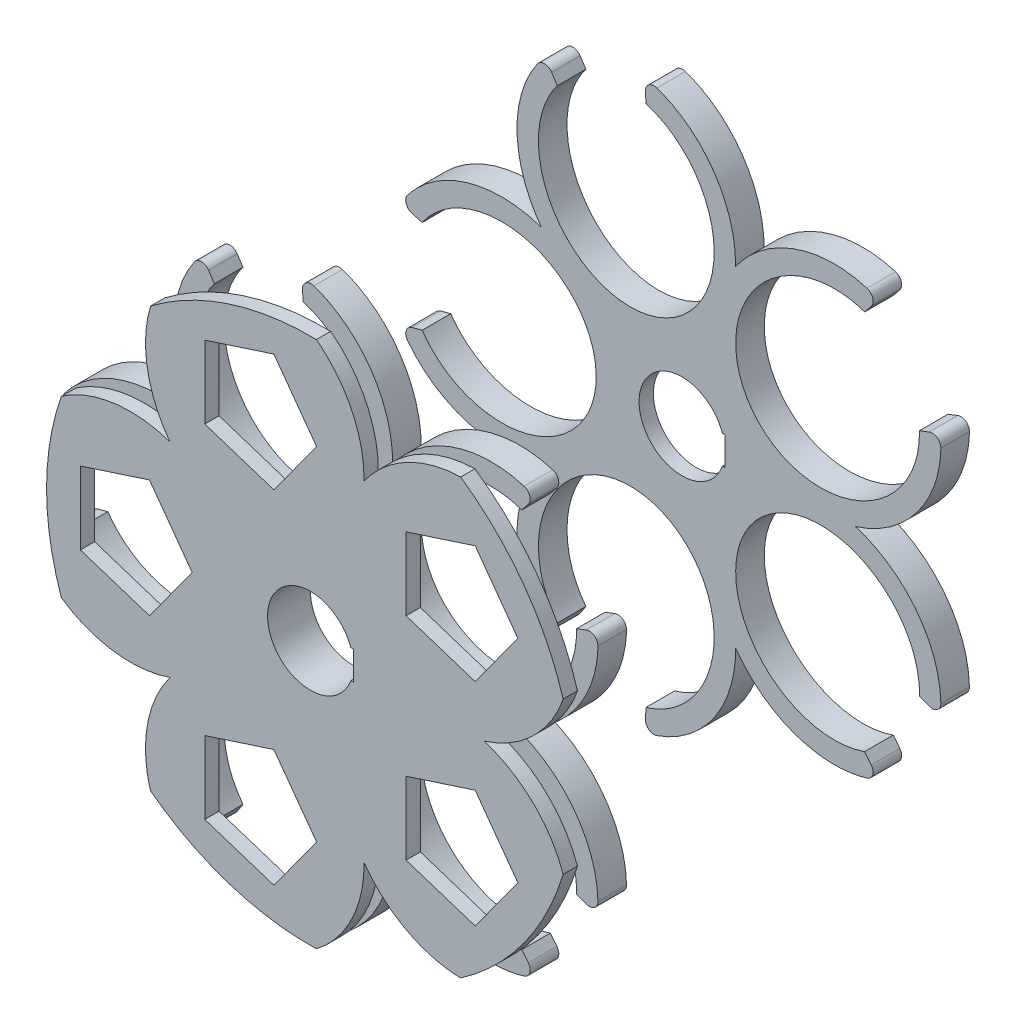
from build123d import *

# Parameters (mm, degrees)
BOSS_EXTRUDE1_DEPTH = 10
CIRPATTERN1_COUNT   = 5
SKETCH4_R           = 15
BOSS_EXTRUDE2_DEPTH = 5
LPATTERN1_COUNT     = 2
LPATTERN1_PITCH     = 120
BOSS_EXTRUDE3_START = 5
SKETCH5_R           = 15
BOSS_EXTRUDE3_DEPTH = 5
BOSS_EXTRUDE4_START = 5
SKETCH6_R           = 15
BOSS_EXTRUDE4_DEPTH = 5
SKETCH7_W           = 0.857864376
SKETCH7_H           = 10
CUT_EXTRUDE1_DEPTH  = 197.479113475


with BuildPart() as part:
    # Sketch1 → Boss-Extrude1 (new body)
    with BuildSketch(Plane.XY):
        with BuildLine():
            Line((-90.882850735, 16.313510687), (-94.428028859, 17.263438303))
            ThreePointArc((-94.428028859, 17.263438303), (-96.488628296, 19.185967093), (-96.045623977, 21.969118933))
            add(Edge.make_bspline(
                [(-96.045623977, -21.969118933), (-22.5, -119.359328544), (-22.5, 0), (-22.5, 119.359328544), (-96.045623977, 21.969118933)],
                knots=[3.758033427, 3.758033427, 3.758033427, 6.283185307, 6.283185307, 8.808337187, 8.808337187, 8.808337187], degree=2, weights=[1, 0.303363369, 1, 0.303363369, 1]))
            ThreePointArc((-96.045623977, -21.969118933), (-96.488628296, -19.185967093), (-94.428028859, -17.263438303))
            Line((-94.428028859, -17.263438303), (-90.882850735, -16.313510687))
            add(Edge.make_bspline(
                [(-90.882850735, -16.313510687), (-30, -105.204250416), (-30, 0), (-30, 105.204250416), (-90.882850735, 16.313510687)],
                knots=[3.705945592, 3.705945592, 3.705945592, 6.283185307, 6.283185307, 8.860425023, 8.860425023, 8.860425023], degree=2, weights=[1, 0.2784467, 1, 0.2784467, 1]))
        make_face()
    extrude(amount=BOSS_EXTRUDE1_DEPTH)


with BuildPart() as cirpattern1_1:
    # CirPattern1: pattern copy
    add(part.part.rotate(Axis((0, 0, 0), (0, 0, 1)), 1 * 360 / CIRPATTERN1_COUNT))


with BuildPart() as cirpattern1_2:
    # CirPattern1: pattern copy
    add(part.part.rotate(Axis((0, 0, 0), (0, 0, 1)), 2 * 360 / CIRPATTERN1_COUNT))


with BuildPart() as cirpattern1_3:
    # CirPattern1: pattern copy
    add(part.part.rotate(Axis((0, 0, 0), (0, 0, 1)), 3 * 360 / CIRPATTERN1_COUNT))


with BuildPart() as cirpattern1_4:
    # CirPattern1: pattern copy
    add(part.part.rotate(Axis((0, 0, 0), (0, 0, 1)), 4 * 360 / CIRPATTERN1_COUNT))


with BuildPart() as part_1:
    add(part.part)

    add(cirpattern1_1.part)  # Boss-Extrude2 merges CirPattern1_1

    add(cirpattern1_2.part)  # Boss-Extrude2 merges CirPattern1_2

    add(cirpattern1_3.part)  # Boss-Extrude2 merges CirPattern1_3

    add(cirpattern1_4.part)  # Boss-Extrude2 merges CirPattern1_4
    # Sketch4 → Boss-Extrude2 (add)
    with BuildSketch(Plane.XY.offset(10)):
        with BuildLine():
            add(Edge.make_bspline(
                [(11.314250367, -34.821682092), (-4.282878688, -13.18134523), (-29.621092019, -21.520983078)],
                knots=[5.681125071, 5.681125071, 5.681125071, 6.885245543, 6.885245543, 6.885245543], degree=2, weights=[1, 0.824170567, 1]))
            add(Edge.make_bspline(
                [(36.613683304, 0), (11.212721975, -8.146519369), (11.314250367, -34.821682092)],
                knots=[5.681125071, 5.681125071, 5.681125071, 6.885245543, 6.885245543, 6.885245543], degree=2, weights=[1, 0.824170567, 1]))
            add(Edge.make_bspline(
                [(11.314250367, 34.821682092), (11.212721975, 8.146519369), (36.613683304, 0)],
                knots=[5.681125071, 5.681125071, 5.681125071, 6.885245543, 6.885245543, 6.885245543], degree=2, weights=[1, 0.824170567, 1]))
            add(Edge.make_bspline(
                [(-29.621092019, 21.520983078), (-4.282878688, 13.18134523), (11.314250367, 34.821682092)],
                knots=[5.681125071, 5.681125071, 5.681125071, 6.885245543, 6.885245543, 6.885245543], degree=2, weights=[1, 0.824170567, 1]))
            add(Edge.make_bspline(
                [(-29.621092019, -21.520983078), (-13.859686574, 0), (-29.621092019, 21.520983078)],
                knots=[2.539532418, 2.539532418, 2.539532418, 3.74365289, 3.74365289, 3.74365289], degree=2, weights=[1, 0.824170567, 1]))
        make_face()
        Circle(SKETCH4_R, mode=Mode.SUBTRACT)
    extrude(amount=-BOSS_EXTRUDE2_DEPTH)


with BuildPart() as lpattern1_1:
    # LPattern1: pattern copy
    add(part_1.part.moved(Location(Vector(0, 0, 1) * (1 * LPATTERN1_PITCH))))

    # Sketch5 → Boss-Extrude3 (add)
    with BuildSketch(Plane.XY.offset(130).offset(BOSS_EXTRUDE3_START)):
        Polygon((9.549150281, 29.389262615), (-25, 18.1635632), (-25, -18.1635632), (9.549150281, -29.389262615), (30.901699437, 0), align=None)
        Circle(SKETCH5_R, mode=Mode.SUBTRACT)
    extrude(amount=-BOSS_EXTRUDE3_DEPTH)

    # Sketch6 → Boss-Extrude4 (add)
    with BuildSketch(Plane.XY.offset(135).offset(BOSS_EXTRUDE4_START)):
        with BuildLine():
            ThreePointArc((-55.942472773, -73.459260333), (-28.533202922, -87.816168897), (2.080141313, -92.311950477))
            add(Edge.make_bspline(
                [(2.080141313, -92.311950477), (19.096140546, -79.431875664), (18.773008887, -57.777380395)],
                knots=[0.931883543, 0.931883543, 0.931883543, 1.919857155, 1.919857155, 1.919857155], degree=2, weights=[1, 0.880449557, 1]))
            add(Edge.make_bspline(
                [(18.773008887, -57.777380395), (31.239782848, -75.486167096), (52.576733428, -75.904613106)],
                knots=[1.221735499, 1.221735499, 1.221735499, 2.209709111, 2.209709111, 2.209709111], degree=2, weights=[1, 0.880449557, 1]))
            ThreePointArc((52.576733428, -75.904613106), (74.700895058, -54.27337714), (88.436681049, -26.547629531))
            add(Edge.make_bspline(
                [(88.436681049, -26.547629531), (81.445234908, -6.384290573), (60.750732901, 0)],
                knots=[4.073476196, 4.073476196, 4.073476196, 5.061449808, 5.061449808, 5.061449808], degree=2, weights=[1, 0.880449557, 1]))
            add(Edge.make_bspline(
                [(60.750732901, 0), (81.445234908, 6.384290573), (88.436681049, 26.547629531)],
                knots=[1.221735499, 1.221735499, 1.221735499, 2.209709111, 2.209709111, 2.209709111], degree=2, weights=[1, 0.880449557, 1]))
            ThreePointArc((88.436681049, 26.547629531), (74.700895058, 54.27337714), (52.576733428, 75.904613106))
            add(Edge.make_bspline(
                [(52.576733428, 75.904613106), (31.239782848, 75.486167096), (18.773008887, 57.777380395)],
                knots=[4.073476196, 4.073476196, 4.073476196, 5.061449808, 5.061449808, 5.061449808], degree=2, weights=[1, 0.880449557, 1]))
            add(Edge.make_bspline(
                [(18.773008887, 57.777380395), (19.096140546, 79.431875664), (2.080141313, 92.311950477)],
                knots=[4.363328152, 4.363328152, 4.363328152, 5.351301765, 5.351301765, 5.351301765], degree=2, weights=[1, 0.880449557, 1]))
            ThreePointArc((2.080141313, 92.311950477), (-28.533202922, 87.816168897), (-55.942472773, 73.459260333))
            add(Edge.make_bspline(
                [(-55.942472773, 73.459260333), (-62.137987306, 53.037307518), (-49.148375337, 35.708384865)],
                knots=[0.931883543, 0.931883543, 0.931883543, 1.919857155, 1.919857155, 1.919857155], degree=2, weights=[1, 0.880449557, 1]))
            add(Edge.make_bspline(
                [(-49.148375337, 35.708384865), (-69.643170996, 42.707308378), (-87.151083016, 30.504293432)],
                knots=[4.363328152, 4.363328152, 4.363328152, 5.351301765, 5.351301765, 5.351301765], degree=2, weights=[1, 0.880449557, 1]))
            ThreePointArc((-87.151083016, 30.504293432), (-92.335384272, 0), (-87.151083016, -30.504293432))
            add(Edge.make_bspline(
                [(-87.151083016, -30.504293432), (-69.643170996, -42.707308378), (-49.148375337, -35.708384865)],
                knots=[0.931883543, 0.931883543, 0.931883543, 1.919857155, 1.919857155, 1.919857155], degree=2, weights=[1, 0.880449557, 1]))
            add(Edge.make_bspline(
                [(-49.148375337, -35.708384865), (-62.137987306, -53.037307518), (-55.942472773, -73.459260333)],
                knots=[4.363328152, 4.363328152, 4.363328152, 5.351301765, 5.351301765, 5.351301765], degree=2, weights=[1, 0.880449557, 1]))
        make_face()
        Circle(SKETCH6_R, mode=Mode.SUBTRACT)
        Polygon((2.163118961, 59.916560527), (-12.783665449, 80.489044357), (-36.968070646, 72.631054767), (-36.968070646, 47.202066287), (-12.783665449, 39.344076696), align=None, mode=Mode.SUBTRACT)
        Polygon((-41.368810394, 0), (-56.315594803, 20.57248383), (-80.5, 12.71449424), (-80.5, -12.71449424), (-56.315594803, -20.57248383), align=None, mode=Mode.SUBTRACT)
        Polygon((57.652475842, 16.457987064), (72.599260252, 37.030470894), (57.652475842, 57.602954725), (33.468070646, 49.744965135), (33.468070646, 24.315976654), align=None, mode=Mode.SUBTRACT)
        Polygon((33.468070646, -49.744965135), (57.652475842, -57.602954725), (72.599260252, -37.030470894), (57.652475842, -16.457987064), (33.468070646, -24.315976654), align=None, mode=Mode.SUBTRACT)
        Polygon((-36.968070646, -47.202066287), (-36.968070646, -72.631054767), (-12.783665449, -80.489044357), (2.163118961, -59.916560527), (-12.783665449, -39.344076696), align=None, mode=Mode.SUBTRACT)
    extrude(amount=-BOSS_EXTRUDE4_DEPTH)


with BuildPart() as cut_extrude1_tool:
    # Sketch7 → Cut-Extrude1 (new, through all)
    with BuildSketch(Plane.XY.offset(140)):
        with Locations((14.571067812, 0)):
            Rectangle(SKETCH7_W, SKETCH7_H)
    extrude(amount=-CUT_EXTRUDE1_DEPTH)


with BuildPart() as part_2:
    add(part_1.part)

    # Cut-Extrude1: cut by cut_extrude1_tool
    add(cut_extrude1_tool.part, mode=Mode.SUBTRACT)


with BuildPart() as lpattern1_1_1:
    add(lpattern1_1.part)

    # Cut-Extrude1: cut by cut_extrude1_tool
    add(cut_extrude1_tool.part, mode=Mode.SUBTRACT)


solid = Compound([part_2.part, lpattern1_1_1.part])
